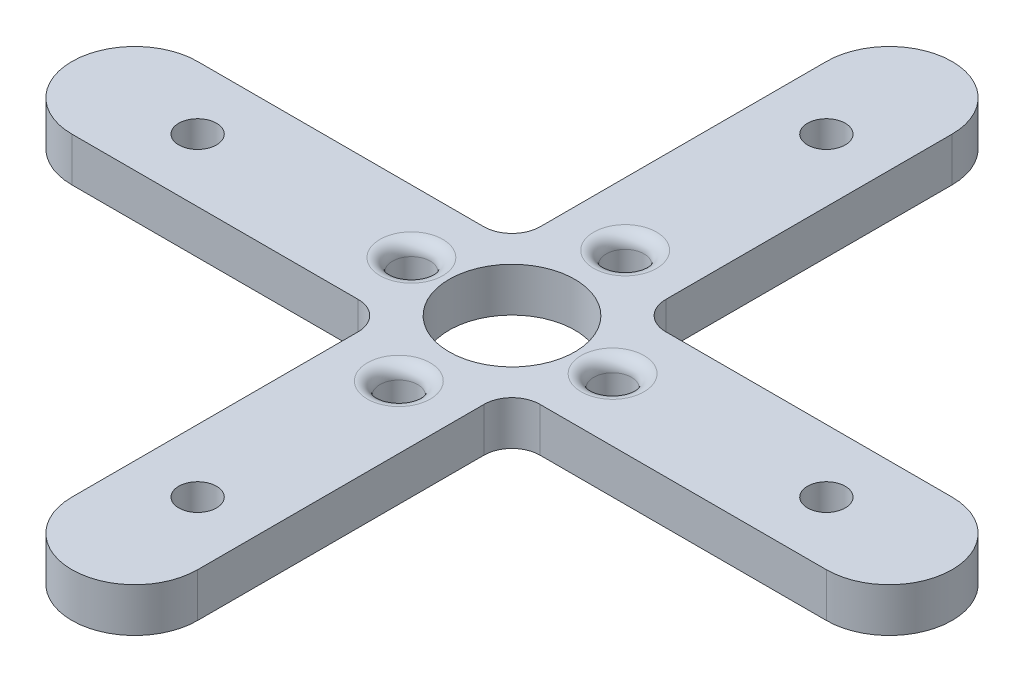
from build123d import *

# Parameters (mm, degrees)
CROQUIS1_R              = 1.5
CROQUIS1_R_2            = 5
SALIENTE_EXTRUIR2_DEPTH = 3.5
REDONDEO9_R             = 1
REDONDEO10_R            = 1
REDONDEO11_R            = 1
REDONDEO12_R            = 1


with BuildPart() as part:
    # Croquis1 → Saliente-Extruir2 (new body)
    with BuildSketch(Plane(origin=(0, 0, 0), x_dir=(1, 0, 0), z_dir=(0, 1, 0))):
        with BuildLine():
            Line((1.47572532, 11.484579709), (1.47572532, 3.695762793))
            ThreePointArc((1.47572532, 3.695762793), (0.818994747, 2.110274939), (-0.766493108, 1.453544366))
            Line((-0.766493108, 1.453544366), (-23.52427468, 1.453544366))
            ThreePointArc((-23.52427468, 1.453544366), (-28.52427468, -3.546455634), (-23.52427468, -8.546455634))
            Line((-23.52427468, -8.546455634), (-0.766493108, -8.546455634))
            ThreePointArc((-0.766493108, -8.546455634), (0.818994747, -9.203186206), (1.47572532, -10.788674061))
            Line((1.47572532, -10.788674061), (1.47572532, -18.577490976))
            Line((1.47572532, -18.577490976), (1.47572532, -33.546455634))
            ThreePointArc((1.47572532, -33.546455634), (6.47572532, -38.546455634), (11.47572532, -33.546455634))
            Line((11.47572532, -33.546455634), (11.47572532, -10.788674061))
            Line((11.47572532, -10.788674061), (11.47572532, -10.748363891))
            ThreePointArc((11.47572532, -10.748363891), (12.133603326, -9.190173106), (13.697697252, -8.546455634))
            Line((13.697697252, -8.546455634), (36.47572532, -8.546455634))
            ThreePointArc((36.47572532, -8.546455634), (41.47572532, -3.546455634), (36.47572532, 1.453544366))
            Line((36.47572532, 1.453544366), (13.697697252, 1.453544366))
            ThreePointArc((13.697697252, 1.453544366), (12.133603326, 2.097261838), (11.47572532, 3.655452623))
            Line((11.47572532, 3.655452623), (11.47572532, 3.695762793))
            Line((11.47572532, 3.695762793), (11.47572532, 26.453544366))
            ThreePointArc((11.47572532, 26.453544366), (6.47572532, 31.453544366), (1.47572532, 26.453544366))
            Line((1.47572532, 26.453544366), (1.47572532, 11.484579709))
        make_face()
        with Locations(Location((-1.52427468, -3.546455634, 0), (0, 0, 270))):
            Circle(CROQUIS1_R, mode=Mode.SUBTRACT)
        with Locations(Location((6.47572532, -28.546455634, 0), (0, 0, 270))):
            Circle(CROQUIS1_R, mode=Mode.SUBTRACT)
        with Locations(Location((6.47572532, -12.546455634, 0), (0, 0, 270))):
            Circle(CROQUIS1_R, mode=Mode.SUBTRACT)
        with Locations(Location((-18.52427468, -3.546455634, 0), (0, 0, 270))):
            Circle(CROQUIS1_R, mode=Mode.SUBTRACT)
        with Locations(Location((6.47572532, -3.546455634, 0), (0, 0, 270))):
            Circle(CROQUIS1_R_2, mode=Mode.SUBTRACT)
        with Locations(Location((14.47572532, -3.546455634, 0), (0, 0, 270))):
            Circle(CROQUIS1_R, mode=Mode.SUBTRACT)
        with Locations(Location((6.47572532, 5.453544366, 0), (0, 0, 270))):
            Circle(CROQUIS1_R, mode=Mode.SUBTRACT)
        with Locations(Location((31.47572532, -3.546455634, 0), (0, 0, 270))):
            Circle(CROQUIS1_R, mode=Mode.SUBTRACT)
        with Locations(Location((6.47572532, 21.453544366, 0), (0, 0, 270))):
            Circle(CROQUIS1_R, mode=Mode.SUBTRACT)
    extrude(amount=SALIENTE_EXTRUIR2_DEPTH)

    # Redondeo9
    redondeo9_edges = [part.edges().sort_by_distance(p)[0] for p in [
        (6.47572532, 3.5, -6.953544366),
    ]]
    fillet(redondeo9_edges, radius=REDONDEO9_R)

    # Redondeo10
    redondeo10_edges = [part.edges().sort_by_distance(p)[0] for p in [
        (14.47572532, 3.5, 2.046455634),
    ]]
    fillet(redondeo10_edges, radius=REDONDEO10_R)

    # Redondeo11
    redondeo11_edges = [part.edges().sort_by_distance(p)[0] for p in [
        (6.47572532, 3.5, 11.046455634),
    ]]
    fillet(redondeo11_edges, radius=REDONDEO11_R)

    # Redondeo12
    redondeo12_edges = [part.edges().sort_by_distance(p)[0] for p in [
        (-1.52427468, 3.5, 2.046455634),
    ]]
    fillet(redondeo12_edges, radius=REDONDEO12_R)


solid = part.part
